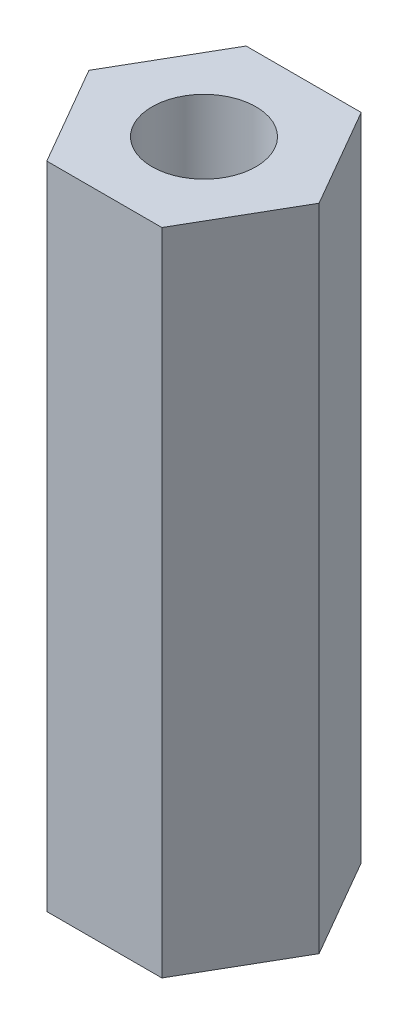
from build123d import *

# Parameters (mm, degrees)
SKETCH_1_R      = 1.2
EXTRUDE_1_DEPTH = 15


with BuildPart() as part:
    # 草图1 → 凸台-拉伸1 (new body)
    with BuildSketch(Plane(origin=(0, 0, 0), x_dir=(1, 0, 0), z_dir=(0, 1, 0))):
        Polygon((2.655811238, 0), (1.327905619, 2.3), (-1.327905619, 2.3), (-2.655811238, 0), (-1.327905619, -2.3), (1.327905619, -2.3), align=None)
        with Locations(Location((0, 0, 0), (0, 0, 270))):
            Circle(SKETCH_1_R, mode=Mode.SUBTRACT)
    extrude(amount=EXTRUDE_1_DEPTH)


solid = part.part
